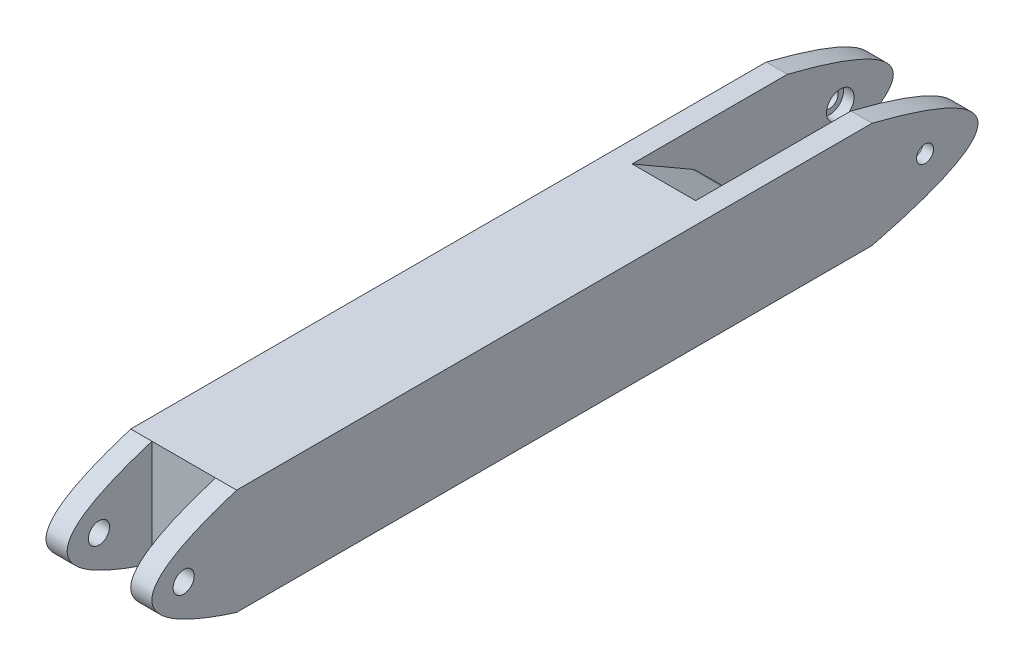
from build123d import *

# Parameters (mm, degrees)
SKETCH1_R               = 5
SKETCH1_R_2             = 4
BOSS_EXTRUDE1_DEPTH     = 50
CUT_EXTRUDE1_DEPTH      = 52
CUT_EXTRUDE1_DEPTH_BACK = 35
SKETCH2_W               = 30
SKETCH2_H               = 80
SKETCH3_W               = 30
SKETCH3_H               = 40
CUT_EXTRUDE2_DEPTH      = 52
CUT_EXTRUDE3_START      = -10
CUT_EXTRUDE3_DEPTH      = 30
CUT_EXTRUDE4_START      = -10
CUT_EXTRUDE4_DEPTH      = 30
FILLET1_R               = 10
SKETCH7_R               = 6.5
CUT_EXTRUDE5_DEPTH      = 5
CUT_EXTRUDE6_START      = -5
SKETCH6_R               = 6.5
CUT_EXTRUDE6_DEPTH      = 5
SKETCH8_R               = 3
CUT_EXTRUDE8_DEPTH      = 16


with BuildPart() as part:
    # Sketch1 → Boss-Extrude1 (new body)
    with BuildSketch(Plane(origin=(0, 0, 0), x_dir=(0, 0, -1), z_dir=(1, 0, 0))):
        with BuildLine():
            Line((-255.87149894, 42.046001407), (44.12850106, 42.046001407))
            add(Edge.make_bspline(
                [(44.12850106, 42.046001407), (144.12850106, 17.046001407), (44.12850106, -7.953998593)],
                knots=[0, 0, 0, 1, 1, 1], degree=2))
            Line((44.12850106, -7.953998593), (-255.87149894, -7.953998593))
            add(Edge.make_bspline(
                [(-255.87149894, 42.046001407), (-335.87149894, 17.046001407), (-255.87149894, -7.953998593)],
                knots=[0, 0, 0, 1, 1, 1], degree=2))
        make_face()
        with Locations((-280.87149894, 17.046001407)):
            Circle(SKETCH1_R, mode=Mode.SUBTRACT)
        with Locations((69.12850106, 17.046001407)):
            Circle(SKETCH1_R_2, mode=Mode.SUBTRACT)
    extrude(amount=BOSS_EXTRUDE1_DEPTH)

    # Sketch2 → Cut-Extrude1 (cut, two sides: drawn at the far end of the back side and taken through both)
    with BuildSketch(Plane(origin=(0, 0, 0), x_dir=(1, 0, 0), z_dir=(0, 1, 0)).offset(-CUT_EXTRUDE1_DEPTH_BACK)):
        with Locations((25, 54.12850106)):
            Rectangle(SKETCH2_W, SKETCH2_H)
    extrude(amount=CUT_EXTRUDE1_DEPTH + CUT_EXTRUDE1_DEPTH_BACK, mode=Mode.SUBTRACT)

    # Sketch3 → Cut-Extrude2 (cut)
    with BuildSketch(Plane.XZ.offset(7.953998593)):
        with Locations((25, 275.87149894)):
            Rectangle(SKETCH3_W, SKETCH3_H)
    extrude(amount=-CUT_EXTRUDE2_DEPTH, mode=Mode.SUBTRACT)

    # Sketch4 → Cut-Extrude3 (cut)
    with BuildSketch(Plane.ZY.offset(CUT_EXTRUDE3_START)):
        Polygon((-14.12850106, 17.046001407), (-14.12850106, 42.046001407), (29.172769129, 42.046001407), align=None)
    extrude(amount=-CUT_EXTRUDE3_DEPTH, mode=Mode.SUBTRACT)

    # Sketch5 → Cut-Extrude4 (cut)
    with BuildSketch(Plane.ZY.offset(CUT_EXTRUDE4_START)):
        Polygon((-14.12850106, -7.953998593), (-14.12850106, 17.046001407), (29.172769129, -7.953998593), align=None)
    extrude(amount=-CUT_EXTRUDE4_DEPTH, mode=Mode.SUBTRACT)

    # Fillet1
    fillet1_edges = [part.edges().sort_by_distance(p)[0] for p in [
        (25, 17.046001407, -14.12850106),
    ]]
    fillet(fillet1_edges, radius=FILLET1_R)

    # Sketch7 → Cut-Extrude5 (cut)
    with BuildSketch(Plane.ZY.offset(-40)):
        with Locations((-69.12850106, 17.046001407)):
            Circle(SKETCH7_R)
    extrude(amount=-CUT_EXTRUDE5_DEPTH, mode=Mode.SUBTRACT)

    # Sketch6 → Cut-Extrude6 (cut)
    with BuildSketch(Plane(origin=(10, 0, 0), x_dir=(0, 0, -1), z_dir=(1, 0, 0)).offset(CUT_EXTRUDE6_START)):
        with Locations(Location((69.12850106, 17.046001407, 0), (0, 0, 180))):
            Circle(SKETCH6_R)
    extrude(amount=CUT_EXTRUDE6_DEPTH, mode=Mode.SUBTRACT)

    # Sketch8 → Cut-Extrude8 (cut)
    with BuildSketch(Plane.ZY):
        with Locations(Location((15.87149894, 7.046001407, 0), (0, 0, 180))):
            Circle(SKETCH8_R)
        with Locations((15.87149894, 27.046001407)):
            Circle(SKETCH8_R)
    extrude(amount=-CUT_EXTRUDE8_DEPTH, mode=Mode.SUBTRACT)


solid = part.part
